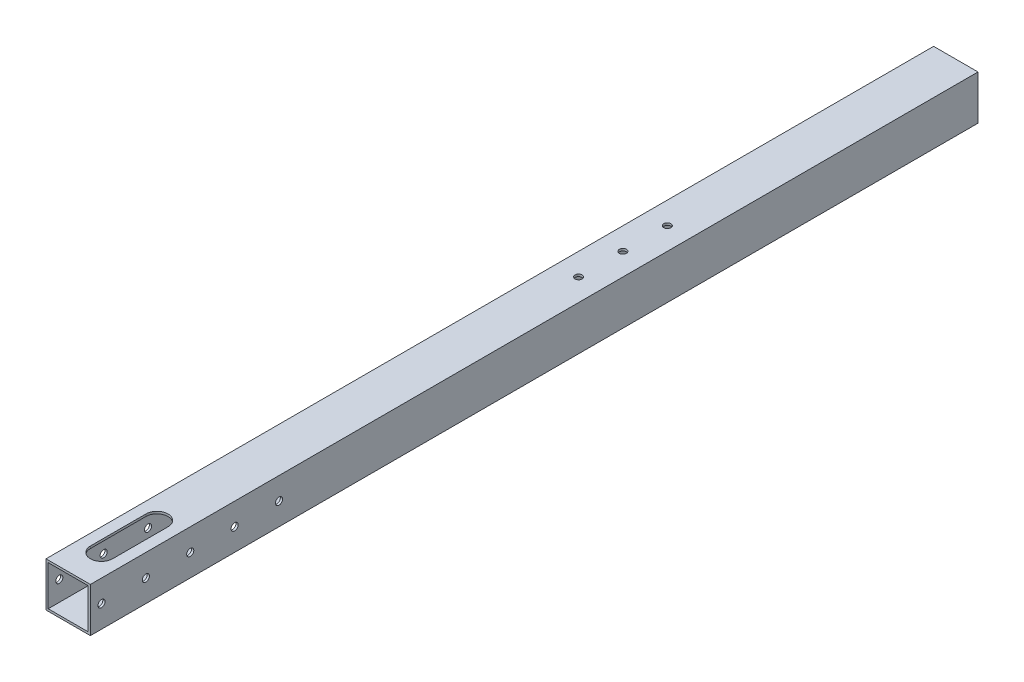
from build123d import *

# Parameters (mm, degrees)
SKETCH_1_W          = 20
SKETCH_1_H          = 20
SKETCH_1_W_2        = 18
SKETCH_1_H_2        = 18
EXTRUDE_1_DEPTH     = 400
SKETCH_2_R          = 1.6
CUT_EXTRUDE_1_DEPTH = 401.998753115
CUT_EXTRUDE_2_REACH = 402.999
CUT_EXTRUDE_3_REACH = 402.999
SKETCH_5_R          = 1.6
CUT_EXTRUDE_4_DEPTH = 401.998753115


with BuildPart() as part:
    # 草图1 → 拉伸-薄壁1 (new body)
    with BuildSketch(Plane.XY):
        with Locations((10, -10)):
            Rectangle(SKETCH_1_W, SKETCH_1_H)
        with Locations((10, -10)):
            Rectangle(SKETCH_1_W_2, SKETCH_1_H_2, mode=Mode.SUBTRACT)
    extrude(amount=EXTRUDE_1_DEPTH)

    # 草图2 → 切除-拉伸1 (cut, through all)
    with BuildSketch(Plane(origin=(20, 0, 0), x_dir=(0, 0, -1), z_dir=(1, 0, 0))):
        with Locations(Location((-395, -10, 0), (0, 0, 90))):
            Circle(SKETCH_2_R)
        with Locations(Location((-375, -10, 0), (0, 0, 90))):
            Circle(SKETCH_2_R)
        with Locations(Location((-355, -10, 0), (0, 0, 90))):
            Circle(SKETCH_2_R)
        with Locations(Location((-335, -10, 0), (0, 0, 90))):
            Circle(SKETCH_2_R)
        with Locations(Location((-315, -10, 0), (0, 0, 90))):
            Circle(SKETCH_2_R)
    extrude(amount=-CUT_EXTRUDE_1_DEPTH, mode=Mode.SUBTRACT)

    # 草图3 → 切除-拉伸2 (cut, up to next)
    with BuildSketch(Plane(origin=(0, 0, 0), x_dir=(1, 0, 0), z_dir=(0, 1, 0)), mode=Mode.PRIVATE) as cut_extrude_2_sk1:
        with BuildLine():
            Line((15, -360), (15, -385))
            ThreePointArc((15, -385), (10, -390), (5, -385))
            Line((5, -385), (5, -360))
            ThreePointArc((5, -360), (10, -355), (15, -360))
        make_face()
    cut_extrude_2_tool1 = extrude(cut_extrude_2_sk1.sketch, amount=-CUT_EXTRUDE_2_REACH, mode=Mode.PRIVATE) & part.part
    add(cut_extrude_2_tool1.solids().sort_by_distance((10, 0, 372.5))[0], mode=Mode.SUBTRACT)

    # 草图4 → 切除-拉伸3 (cut, up to next)
    with BuildSketch(Plane.XZ.offset(20), mode=Mode.PRIVATE) as cut_extrude_3_sk1:
        with BuildLine():
            Line((15, 335), (15, 315))
            ThreePointArc((15, 315), (10, 310), (5, 315))
            Line((5, 315), (5, 335))
            ThreePointArc((5, 335), (10, 340), (15, 335))
        make_face()
    cut_extrude_3_tool1 = extrude(cut_extrude_3_sk1.sketch, amount=-CUT_EXTRUDE_3_REACH, mode=Mode.PRIVATE) & part.part
    add(cut_extrude_3_tool1.solids().sort_by_distance((10, -20, 325))[0], mode=Mode.SUBTRACT)

    # 草图5 → 切除-拉伸4 (cut, through all)
    with BuildSketch(Plane(origin=(0, 0, 0), x_dir=(1, 0, 0), z_dir=(0, 1, 0))):
        with Locations(Location((10, -130, 0), (0, 0, 270))):
            Circle(SKETCH_5_R)
        with Locations(Location((10, -150, 0), (0, 0, 270))):
            Circle(SKETCH_5_R)
        with Locations(Location((10, -170, 0), (0, 0, 270))):
            Circle(SKETCH_5_R)
    extrude(amount=-CUT_EXTRUDE_4_DEPTH, mode=Mode.SUBTRACT)


solid = part.part
